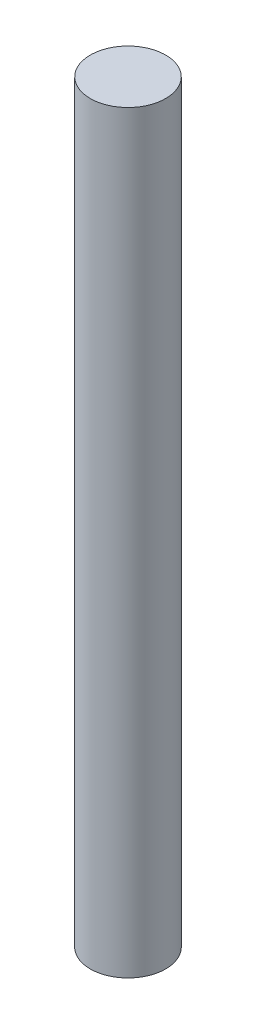
from build123d import *

# Parameters (mm, degrees)
SKIZZE1_R                       = 15
AUFSATZ_LINEAR_AUSTRAGEN1_DEPTH = 300


with BuildPart() as part:
    # Skizze1 → Aufsatz-Linear austragen1 (new body)
    with BuildSketch(Plane(origin=(0, 0, 0), x_dir=(1, 0, 0), z_dir=(0, 1, 0))):
        with Locations(Location((0, 0, 0), (0, 0, 270))):
            Circle(SKIZZE1_R)
    extrude(amount=AUFSATZ_LINEAR_AUSTRAGEN1_DEPTH)


solid = part.part
